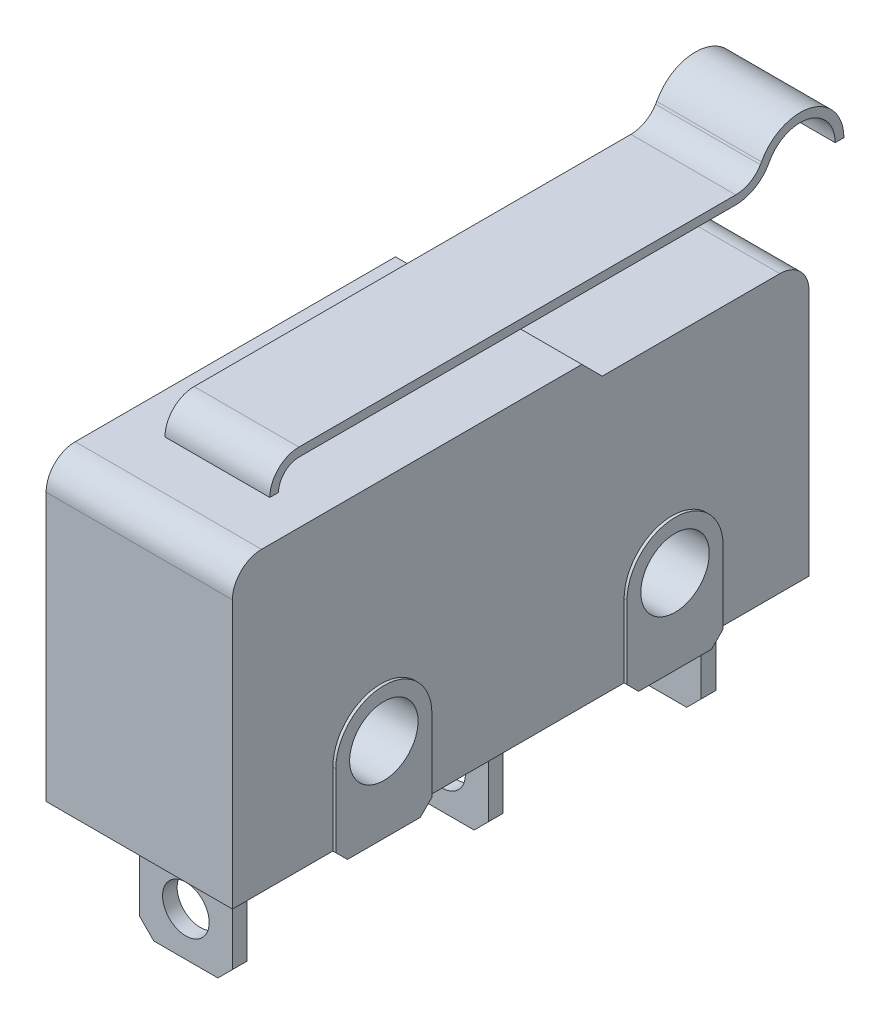
from build123d import *

# Parameters (mm, degrees)
EXTRUDE_1_DEPTH        = 3.2
SKETCH_3_W             = 0.5
SKETCH_3_H             = 3.9
EXTRUDE_3_DEPTH        = 1.6
CHAMFER_1_SIZE         = 0.5
SKETCH_4_R             = 0.8
CUT_EXTRUDE_1_DEPTH    = 22.107344693
EXTRUDE_4_DEPTH        = 0.1
PATTERN_LINEAR_1_COUNT = 2
PATTERN_LINEAR_1_PITCH = 10
MIRROR_1_COPY_1_DEPTH  = 0.1
SKETCH_6_R             = 1.175
CUT_EXTRUDE_2_DEPTH    = 24.230152819
EXTRUDE_2_DEPTH        = 1.8


with BuildPart() as part:
    # ｽｹｯﾁ1 → ﾎﾞｽ - 押し出し1 (new, symmetric)
    with BuildSketch(Plane(origin=(0, 0, 0), x_dir=(0, 0, -1), z_dir=(1, 0, 0))):
        with BuildLine():
            Line((12, 10.2), (12.7, 9.5))
            Line((12.7, 9.5), (18.8, 9.5))
            ThreePointArc((18.8, 9.5), (19.507106781, 9.207106781), (19.8, 8.5))
            Line((19.8, 8.5), (19.8, 0))
            Line((19.8, 0), (0, 0))
            Line((0, 0), (0, 9.2))
            ThreePointArc((0, 9.2), (0.292893219, 9.907106781), (1, 10.2))
            Line((1, 10.2), (12, 10.2))
        make_face()
    extrude(amount=EXTRUDE_1_DEPTH, both=True)

    # ｽｹｯﾁ3 → ﾎﾞｽ - 押し出し3 (add, symmetric)
    with BuildSketch(Plane(origin=(0, 0, 0), x_dir=(0, 0, -1), z_dir=(1, 0, 0))):
        with Locations((1.85, -1.95)):
            Rectangle(SKETCH_3_W, SKETCH_3_H)
        with Locations((10.65, -1.95)):
            Rectangle(SKETCH_3_W, SKETCH_3_H)
        with Locations((17.95, -1.95)):
            Rectangle(SKETCH_3_W, SKETCH_3_H)
    extrude(amount=EXTRUDE_3_DEPTH, both=True)

    # 面取り1
    chamfer_1_edges = [part.edges().sort_by_distance(p)[0] for p in [
        (-1.6, -3.9, -1.85),
        (1.6, -3.9, -1.85),
        (-1.6, -3.9, -10.65),
        (1.6, -3.9, -10.65),
        (-1.6, -3.9, -17.95),
        (1.6, -3.9, -17.95),
    ]]
    chamfer(chamfer_1_edges, length=CHAMFER_1_SIZE)

    # ｽｹｯﾁ4 → ｶｯﾄ - 押し出し1 (cut, through all)
    with BuildSketch(Plane(origin=(0, 0, -18.2), x_dir=(-1, 0, 0), z_dir=(0, 0, -1))):
        with Locations((0, -2.4)):
            Circle(SKETCH_4_R)
    extrude(amount=-CUT_EXTRUDE_1_DEPTH, mode=Mode.SUBTRACT)

    # ｽｹｯﾁ5 → ﾎﾞｽ - 押し出し4 (add)
    with BuildSketch(Plane(origin=(3.2, 0, 0), x_dir=(0, 0, -1), z_dir=(1, 0, 0))):
        with BuildLine():
            Line((3.45, 2.5), (3.45, 0))
            Line((3.45, 0), (3.85, -0.4))
            Line((3.85, -0.4), (6.35, -0.4))
            Line((6.35, -0.4), (6.75, 0))
            Line((6.75, 0), (6.75, 2.5))
            ThreePointArc((6.75, 2.5), (5.1, 4.15), (3.45, 2.5))
        make_face()
    extrude_4 = extrude(amount=EXTRUDE_4_DEPTH)

    # 直線ﾊﾟﾀｰﾝ1: ﾎﾞｽ - 押し出し4 ×2
    with Locations(*[(0, 0, -i * PATTERN_LINEAR_1_PITCH) for i in range(1, PATTERN_LINEAR_1_COUNT)]):
        add(extrude_4)

    # ﾐﾗｰ1: ﾎﾞｽ - 押し出し4 across plane
    add(extrude_4.mirror(Plane(origin=(0, 0, 0), x_dir=(0, 0, 1), z_dir=(1, 0, 0))))

    # ﾐﾗｰ1 copy 1 sketch → ﾐﾗｰ1 copy 1 (add)
    with BuildSketch(Plane(origin=(-3.2, 0, -10), x_dir=(0, 0, -1), z_dir=(-1, 0, 0))):
        with BuildLine():
            Line((3.45, -2.5), (3.45, 0))
            Line((3.45, 0), (3.85, 0.4))
            Line((3.85, 0.4), (6.35, 0.4))
            Line((6.35, 0.4), (6.75, 0))
            Line((6.75, 0), (6.75, -2.5))
            ThreePointArc((6.75, -2.5), (5.1, -4.15), (3.45, -2.5))
        make_face()
    extrude(amount=MIRROR_1_COPY_1_DEPTH)

    # ｽｹｯﾁ6 → ｶｯﾄ - 押し出し2 (cut, through all)
    with BuildSketch(Plane(origin=(3.3, 0, 0), x_dir=(0, 0, -1), z_dir=(1, 0, 0))):
        with Locations((5.1, 2.5)):
            Circle(SKETCH_6_R)
        with Locations((15.1, 2.5)):
            Circle(SKETCH_6_R)
    extrude(amount=-CUT_EXTRUDE_2_DEPTH, mode=Mode.SUBTRACT)

    # ｽｹｯﾁ2 → ﾎﾞｽ - 押し出し2 (add, symmetric)
    with BuildSketch(Plane(origin=(0, 0, 0), x_dir=(0, 0, -1), z_dir=(1, 0, 0))):
        with BuildLine():
            Line((3.683747293, 11.2), (18.683747293, 11.2))
            ThreePointArc((18.683747293, 11.2), (19.1692369, 11.325757561), (19.532618528, 11.671400315))
            Line((19.532618528, 11.671400315), (19.570248376, 11.737273482))
            ThreePointArc((19.570248376, 11.737273482), (21.257332173, 12.5), (22.4, 11.043183705))
            Line((22.4, 11.043183705), (22.1, 11.043183705))
            ThreePointArc((22.1, 11.043183705), (21.183255021, 12.209274007), (19.833722345, 11.59368526))
            Line((19.833722345, 11.59368526), (19.790473564, 11.517975834))
            ThreePointArc((19.790473564, 11.517975834), (19.317532977, 11.064960041), (18.683747293, 10.9))
            Line((18.683747293, 10.9), (3.683747293, 10.9))
            ThreePointArc((3.683747293, 10.9), (3.188772547, 10.694974747), (2.983747293, 10.2))
            Line((2.983747293, 10.2), (2.683747293, 10.2))
            ThreePointArc((2.683747293, 10.2), (2.976640512, 10.907106781), (3.683747293, 11.2))
        make_face()
    extrude(amount=EXTRUDE_2_DEPTH, both=True)


solid = part.part
